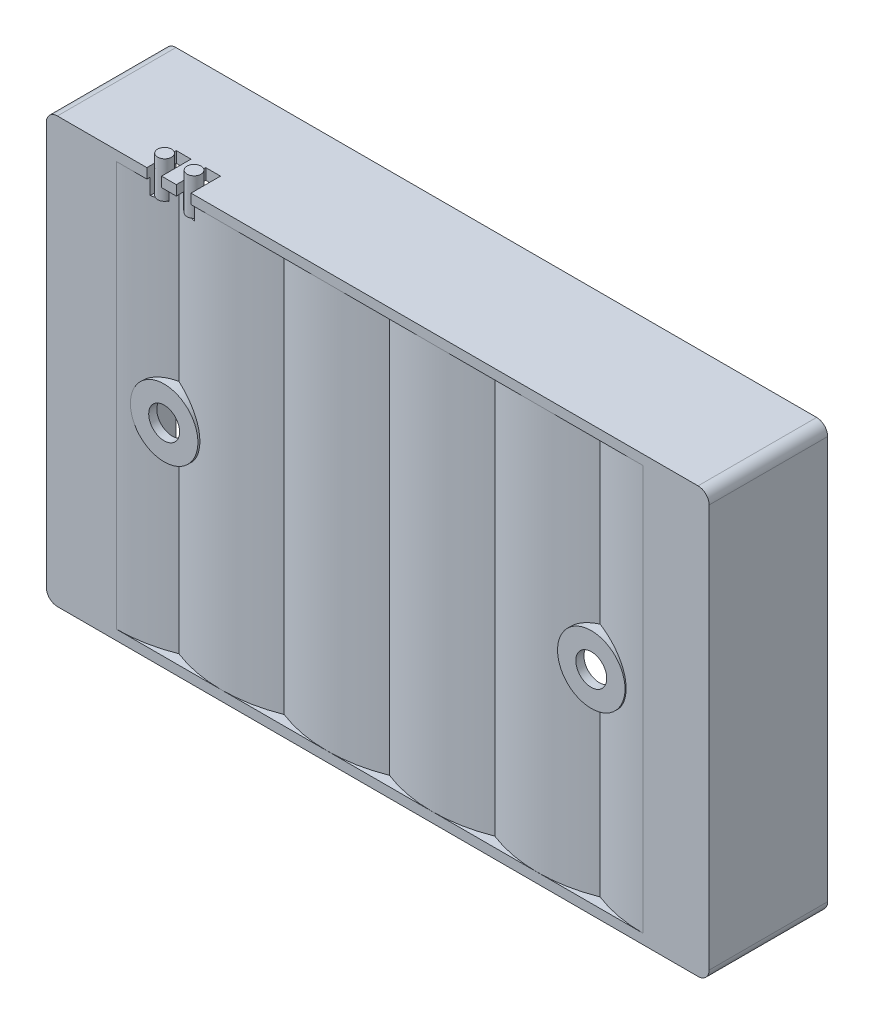
from build123d import *

# Parameters (mm, degrees)
EXTRUDE_1_DEPTH                = 54.7
SKETCH_2_W                     = 1.5
SKETCH_2_H                     = 1.473886678
EXTRUDE_2_DEPTH                = 7.15
SKETCH_3_W                     = 0.15
SKETCH_3_H                     = 1.473886678
EXTRUDE_3_DEPTH                = 7.15
SKETCH_4_W                     = 7.15
SKETCH_4_H                     = 56.35
EXTRUDE_4_DEPTH                = 1.5
SKETCH_5_W                     = 2.973886678
SKETCH_5_H                     = 56.35
EXTRUDE_5_DEPTH                = 14.3
CUT_EXTRUDE_1_DEPTH            = 54.7
SKETCH_7_W                     = 2.973886678
SKETCH_7_H                     = 56.35
EXTRUDE_6_DEPTH                = 14.3
CUT_EXTRUDE_2_DEPTH            = 54.7
SKETCH_9_W                     = 2.973886678
SKETCH_9_H                     = 56.35
EXTRUDE_7_DEPTH                = 14.3
CUT_EXTRUDE_3_DEPTH            = 54.7
SKETCH_11_W                    = 2.973886678
SKETCH_11_H                    = 56.35
EXTRUDE_8_DEPTH                = 14.3
CUT_EXTRUDE_4_DEPTH            = 54.7
EXTRUDE_9_DEPTH                = 7.15
CUT_EXTRUDE_5_DEPTH            = 54.7
CUT_EXTRUDE_6_DEPTH            = 55
CUT_EXTRUDE_7_DEPTH            = 55
CUT_EXTRUDE_8_DEPTH            = 55
CUT_EXTRUDE_9_DEPTH            = 55
CUT_EXTRUDE_10_DEPTH           = 55
SKETCH_20_W                    = 71.5
SKETCH_20_H                    = 1.5
EXTRUDE_10_DEPTH               = 13.126113322
SKETCH_21_W                    = 71.5
SKETCH_21_H                    = 0.15
EXTRUDE_11_DEPTH               = 13.126113322
SKETCH_22_W                    = 16.1
SKETCH_22_H                    = 56.35
EXTRUDE_12_DEPTH               = 9.5
SKETCH_23_W                    = 16.1
SKETCH_23_H                    = 56.35
EXTRUDE_13_DEPTH               = 9
SKETCH_24_W                    = 14.6
SKETCH_24_H                    = 54.7
CUT_EXTRUDE_11_DEPTH           = 8
SKETCH_25_W                    = 14.6
SKETCH_25_H                    = 54.7
CUT_EXTRUDE_12_DEPTH           = 7.5
SKETCH_26_W                    = 90
SKETCH_26_H                    = 16.1
EXTRUDE_14_DEPTH               = 1.35
SKETCH_27_W                    = 4.58
SKETCH_27_H                    = 1.352189545
SKETCH_28_W                    = 4.58
SKETCH_28_H                    = 1.352189545
HOLE_WIZARD_M3_5_1_D           = 4.2
HOLE_WIZARD_M3_5_1_CBORE_D     = 8
HOLE_WIZARD_M3_5_1_CBORE_DEPTH = 1.873886678
FILLET_1_R                     = 1.5
SKETCH_32_W                    = 2
SKETCH_32_H                    = 4
CUT_EXTRUDE_13_DEPTH           = 3.5
SKETCH_35_R                    = 0.95
EXTRUDE_15_DEPTH               = 5


with BuildPart() as part:
    # 草图1 → 凸台-拉伸1 (new body)
    with BuildSketch(Plane(origin=(0, 27.35, 0), x_dir=(1, 0, 0), z_dir=(0, 1, 0))):
        with BuildLine():
            Line((28.85, -5.076113322), (28.85, -6.55))
            Line((28.85, -6.55), (36, -6.55))
            ThreePointArc((36, -6.55), (32.349834184, -6.177694996), (28.85, -5.076113322))
        make_face()
    extrude(amount=-EXTRUDE_1_DEPTH)

    # 草图2 → 凸台-拉伸2 (add)
    with BuildSketch(Plane(origin=(28.85, 0, 0), x_dir=(0, -1, 0), z_dir=(-1, 0, 0))):
        with Locations((28.1, 5.813056661)):
            Rectangle(SKETCH_2_W, SKETCH_2_H)
    extrude(amount=-EXTRUDE_2_DEPTH)

    # 草图3 → 凸台-拉伸3 (add)
    with BuildSketch(Plane(origin=(28.85, 0, 0), x_dir=(0, -1, 0), z_dir=(-1, 0, 0))):
        with Locations((-27.425, 5.813056661)):
            Rectangle(SKETCH_3_W, SKETCH_3_H)
    extrude(amount=-EXTRUDE_3_DEPTH)

    # 草图4 → 凸台-拉伸4 (add)
    with BuildSketch(Plane.XY.offset(6.55)):
        with Locations((32.425, -0.675)):
            Rectangle(SKETCH_4_W, SKETCH_4_H)
    extrude(amount=EXTRUDE_4_DEPTH)

    # 草图5 → 凸台-拉伸5 (add)
    with BuildSketch(Plane.ZY.offset(-28.85)):
        with Locations((6.563056661, -0.675)):
            Rectangle(SKETCH_5_W, SKETCH_5_H)
    extrude(amount=EXTRUDE_5_DEPTH)

    # 草图6 → 切除-拉伸1 (cut)
    with BuildSketch(Plane.XZ.offset(27.35)):
        with BuildLine():
            Line((14.55, 5.076113322), (28.85, 5.076113322))
            ThreePointArc((28.85, 5.076113322), (21.7, 6.55), (14.55, 5.076113322))
        make_face()
    extrude(amount=-CUT_EXTRUDE_1_DEPTH, mode=Mode.SUBTRACT)

    # 草图7 → 凸台-拉伸6 (add)
    with BuildSketch(Plane.ZY.offset(-14.55)):
        with Locations((6.563056661, -0.675)):
            Rectangle(SKETCH_7_W, SKETCH_7_H)
    extrude(amount=EXTRUDE_6_DEPTH)

    # 草图8 → 切除-拉伸2 (cut)
    with BuildSketch(Plane.XZ.offset(27.35)):
        with BuildLine():
            Line((0.25, 5.076113322), (14.55, 5.076113322))
            ThreePointArc((14.55, 5.076113322), (7.4, 6.55), (0.25, 5.076113322))
        make_face()
    extrude(amount=-CUT_EXTRUDE_2_DEPTH, mode=Mode.SUBTRACT)

    # 草图9 → 凸台-拉伸7 (add)
    with BuildSketch(Plane.ZY.offset(-0.25)):
        with Locations((6.563056661, -0.675)):
            Rectangle(SKETCH_9_W, SKETCH_9_H)
    extrude(amount=EXTRUDE_7_DEPTH)

    # 草图10 → 切除-拉伸3 (cut)
    with BuildSketch(Plane.XZ.offset(27.35)):
        with BuildLine():
            Line((-14.05, 5.076113322), (0.25, 5.076113322))
            ThreePointArc((0.25, 5.076113322), (-6.9, 6.55), (-14.05, 5.076113322))
        make_face()
    extrude(amount=-CUT_EXTRUDE_3_DEPTH, mode=Mode.SUBTRACT)

    # 草图11 → 凸台-拉伸8 (add)
    with BuildSketch(Plane.ZY.offset(14.05)):
        with Locations((6.563056661, -0.675)):
            Rectangle(SKETCH_11_W, SKETCH_11_H)
    extrude(amount=EXTRUDE_8_DEPTH)

    # 草图12 → 切除-拉伸4 (cut)
    with BuildSketch(Plane.XZ.offset(27.35)):
        with BuildLine():
            Line((-28.35, 5.076113322), (-14.05, 5.076113322))
            ThreePointArc((-14.05, 5.076113322), (-21.2, 6.55), (-28.35, 5.076113322))
        make_face()
    extrude(amount=-CUT_EXTRUDE_4_DEPTH, mode=Mode.SUBTRACT)

    # 草图13 → 凸台-拉伸9 (add)
    with BuildSketch(Plane.ZY.offset(28.35)):
        with BuildLine():
            Line((5.076113322, 27.35), (5.076113322, 27.5))
            Line((5.076113322, 27.5), (8.05, 27.5))
            Line((8.05, 27.5), (8.05, -28.85))
            Line((8.05, -28.85), (5.076113322, -28.85))
            Line((5.076113322, -28.85), (5.076113322, -27.35))
            add(Edge.make_bspline(
                [(5.076113322, -27.35), (5.076113322, -9.116666667), (5.076113322, 9.116666667), (5.076113322, 27.35)],
                knots=[0, 0, 0, 0, 1, 1, 1, 1], degree=3))
        make_face()
    extrude(amount=EXTRUDE_9_DEPTH)

    # 草图14 → 切除-拉伸5 (cut)
    with BuildSketch(Plane.XZ.offset(27.35)):
        with BuildLine():
            Line((-35.5, 5.076113322), (-28.35, 5.076113322))
            ThreePointArc((-28.35, 5.076113322), (-31.849834184, 6.177694996), (-35.5, 6.55))
            Line((-35.5, 6.55), (-35.5, 5.076113322))
        make_face()
    extrude(amount=-CUT_EXTRUDE_5_DEPTH, mode=Mode.SUBTRACT)

    # 草图15 → 切除-拉伸6 (cut)
    with BuildSketch(Plane(origin=(0, 27.5, 0), x_dir=(-1, 0, 0), z_dir=(0, 1, 0))):
        with BuildLine():
            Line((21.2, 8.05), (6.9, 8.05))
            ThreePointArc((6.9, 8.05), (10.538369022, 7.708982887), (14.05, 6.697810455))
            ThreePointArc((14.05, 6.697810455), (17.561630978, 7.708982887), (21.2, 8.05))
        make_face()
    extrude(amount=-CUT_EXTRUDE_6_DEPTH, mode=Mode.SUBTRACT)

    # 草图16 → 切除-拉伸7 (cut)
    with BuildSketch(Plane(origin=(0, 27.5, 0), x_dir=(-1, 0, 0), z_dir=(0, 1, 0))):
        with BuildLine():
            Line((6.9, 8.05), (-7.4, 8.05))
            ThreePointArc((-7.4, 8.05), (-3.761630978, 7.708982887), (-0.25, 6.697810455))
            ThreePointArc((-0.25, 6.697810455), (3.261630978, 7.708982887), (6.9, 8.05))
        make_face()
    extrude(amount=-CUT_EXTRUDE_7_DEPTH, mode=Mode.SUBTRACT)

    # 草图17 → 切除-拉伸8 (cut)
    with BuildSketch(Plane(origin=(0, 27.5, 0), x_dir=(-1, 0, 0), z_dir=(0, 1, 0))):
        with BuildLine():
            Line((-7.4, 8.05), (-21.7, 8.05))
            ThreePointArc((-21.7, 8.05), (-18.061630978, 7.708982887), (-14.55, 6.697810455))
            ThreePointArc((-14.55, 6.697810455), (-11.038369022, 7.708982887), (-7.4, 8.05))
        make_face()
    extrude(amount=-CUT_EXTRUDE_8_DEPTH, mode=Mode.SUBTRACT)

    # 草图18 → 切除-拉伸9 (cut)
    with BuildSketch(Plane(origin=(0, 27.5, 0), x_dir=(-1, 0, 0), z_dir=(0, 1, 0))):
        with BuildLine():
            Line((-21.7, 8.05), (-36, 8.05))
            ThreePointArc((-36, 8.05), (-32.361630978, 7.708982887), (-28.85, 6.697810455))
            ThreePointArc((-28.85, 6.697810455), (-25.338369022, 7.708982887), (-21.7, 8.05))
        make_face()
    extrude(amount=-CUT_EXTRUDE_9_DEPTH, mode=Mode.SUBTRACT)

    # 草图19 → 切除-拉伸10 (cut)
    with BuildSketch(Plane(origin=(0, 27.5, 0), x_dir=(-1, 0, 0), z_dir=(0, 1, 0))):
        with BuildLine():
            Line((35.5, 8.05), (21.2, 8.05))
            ThreePointArc((21.2, 8.05), (24.838369022, 7.708982887), (28.35, 6.697810455))
            ThreePointArc((28.35, 6.697810455), (31.861630978, 7.708982887), (35.5, 8.05))
        make_face()
    extrude(amount=-CUT_EXTRUDE_10_DEPTH, mode=Mode.SUBTRACT)

    # 草图20 → 凸台-拉伸10 (add)
    with BuildSketch(Plane(origin=(0, 0, 5.076113322), x_dir=(-1, 0, 0), z_dir=(0, 0, -1))):
        with Locations((-0.25, -28.1)):
            Rectangle(SKETCH_20_W, SKETCH_20_H)
    extrude(amount=EXTRUDE_10_DEPTH)

    # 草图21 → 凸台-拉伸11 (add)
    with BuildSketch(Plane(origin=(0, 0, 5.076113322), x_dir=(-1, 0, 0), z_dir=(0, 0, -1))):
        with Locations((-0.25, 27.425)):
            Rectangle(SKETCH_21_W, SKETCH_21_H)
    extrude(amount=EXTRUDE_11_DEPTH)

    # 草图22 → 凸台-拉伸12 (add)
    with BuildSketch(Plane.ZY.offset(35.5)):
        with Locations((0, -0.675)):
            Rectangle(SKETCH_22_W, SKETCH_22_H)
    extrude(amount=EXTRUDE_12_DEPTH)

    # 草图23 → 凸台-拉伸13 (add)
    with BuildSketch(Plane(origin=(36, 0, 0), x_dir=(0, 0, -1), z_dir=(1, 0, 0))):
        with Locations((0, -0.675)):
            Rectangle(SKETCH_23_W, SKETCH_23_H)
    extrude(amount=EXTRUDE_13_DEPTH)

    # 草图24 → 切除-拉伸11 (cut)
    with BuildSketch(Plane(origin=(-35.5, 0, 0), x_dir=(0, 0, -1), z_dir=(1, 0, 0))):
        with Locations((0.75, 0)):
            Rectangle(SKETCH_24_W, SKETCH_24_H)
    extrude(amount=-CUT_EXTRUDE_11_DEPTH, mode=Mode.SUBTRACT)

    # 草图25 → 切除-拉伸12 (cut)
    with BuildSketch(Plane.ZY.offset(-36)):
        with Locations((-0.75, 0)):
            Rectangle(SKETCH_25_W, SKETCH_25_H)
    extrude(amount=-CUT_EXTRUDE_12_DEPTH, mode=Mode.SUBTRACT)

    # 草图26 → 凸台-拉伸14 (add)
    with BuildSketch(Plane(origin=(0, 27.5, 0), x_dir=(-1, 0, 0), z_dir=(0, 1, 0))):
        Rectangle(SKETCH_26_W, SKETCH_26_H)
    extrude(amount=EXTRUDE_14_DEPTH)

    # 草图27 → 旋转1 (revolve)
    with BuildSketch(Plane(origin=(0, 0, 0), x_dir=(1, 0, 0), z_dir=(0, 1, 0))):
        with Locations((-31.29, -7.373905228)):
            Rectangle(SKETCH_27_W, SKETCH_27_H)
    revolve(axis=Axis((-29, 0, 8.05), (0, 0, -1)))

    # 草图28 → 旋转2 (revolve)
    with BuildSketch(Plane(origin=(0, 0, 0), x_dir=(1, 0, 0), z_dir=(0, 1, 0))):
        with Locations((31.29, -7.373905228)):
            Rectangle(SKETCH_28_W, SKETCH_28_H)
    revolve(axis=Axis((29, 0, 6.697810455), (0, 0, 1)))

    # M3.5 六角头机械螺钉的柱形沉头孔1 (through all)
    with Locations(Plane(origin=(0, 0, 5.076113322), x_dir=(-1, 0, 0), z_dir=(0, 0, -1))):
        with Locations((-29, 0), (29, 0)):
            CounterBoreHole(HOLE_WIZARD_M3_5_1_D / 2, HOLE_WIZARD_M3_5_1_CBORE_D / 2, HOLE_WIZARD_M3_5_1_CBORE_DEPTH)

    # 圆角1
    fillet_1_edges = [part.edges().sort_by_distance(p)[0] for p in [
        (-45, -28.85, 0),
        (45, -28.85, 0),
        (45, 28.85, 0),
        (-45, 28.85, 0),
    ]]
    fillet(fillet_1_edges, radius=FILLET_1_R)

    # 草图32 → 切除-拉伸13 (cut)
    with BuildSketch(Plane(origin=(0, 28.85, 0), x_dir=(1, 0, 0), z_dir=(0, 1, 0))):
        with Locations((-30.35, -6.05)):
            Rectangle(SKETCH_32_W, SKETCH_32_H)
        with Locations((-26.35, -6.05)):
            Rectangle(SKETCH_32_W, SKETCH_32_H)
    extrude(amount=-CUT_EXTRUDE_13_DEPTH, mode=Mode.SUBTRACT)

    # 草图35 → 凸台-拉伸15 (add)
    with BuildSketch(Plane(origin=(0, 25.35, 0), x_dir=(1, 0, 0), z_dir=(0, 1, 0))):
        with Locations(Location((-30.35, -6.641832766, 0), (0, 0, 74.804666508))):
            Circle(SKETCH_35_R)
        with Locations(Location((-26.35, -6.641832766, 0), (0, 0, 105.195333492))):
            Circle(SKETCH_35_R)
    extrude(amount=EXTRUDE_15_DEPTH)


solid = part.part
